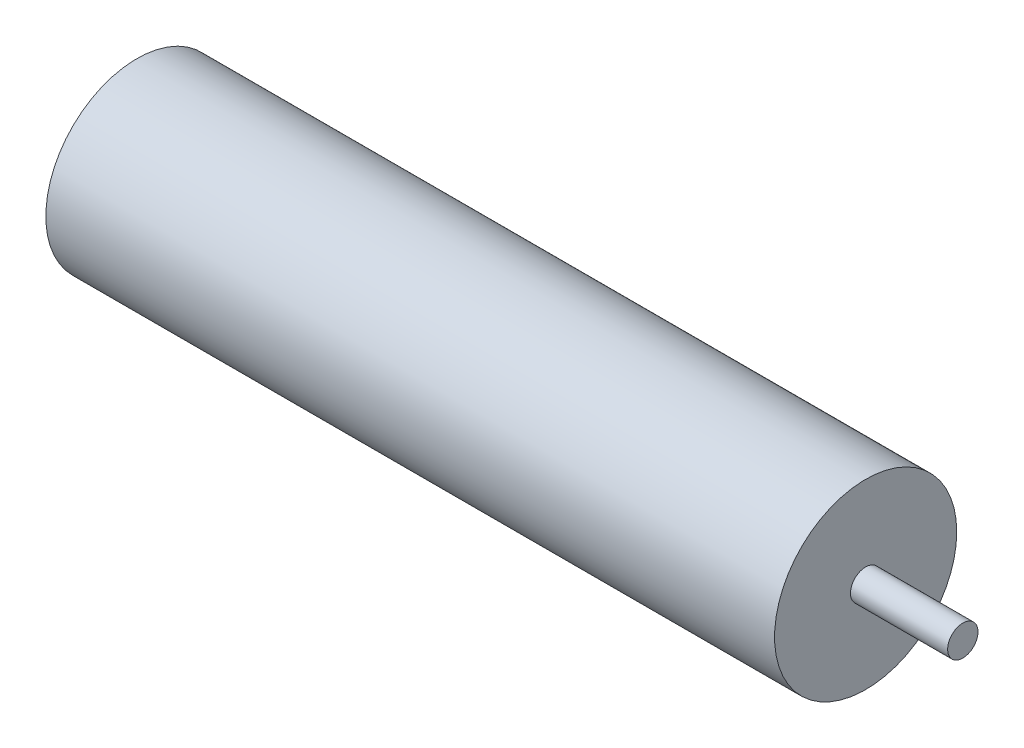
from build123d import *

# Parameters (mm, degrees)
SKETCH1_R           = 15
BOSS_EXTRUDE1_DEPTH = 120
SKETCH2_R           = 2.5
BOSS_EXTRUDE2_DEPTH = 16


with BuildPart() as part:
    # Sketch1 → Boss-Extrude1 (new body)
    with BuildSketch(Plane(origin=(0, 0, 0), x_dir=(0, 0, -1), z_dir=(1, 0, 0))):
        Circle(SKETCH1_R)
    extrude(amount=BOSS_EXTRUDE1_DEPTH)

    # Sketch2 → Boss-Extrude2 (add)
    with BuildSketch(Plane(origin=(120, 0, 0), x_dir=(0, 0, -1), z_dir=(1, 0, 0))):
        Circle(SKETCH2_R)
    extrude(amount=BOSS_EXTRUDE2_DEPTH)


solid = part.part
